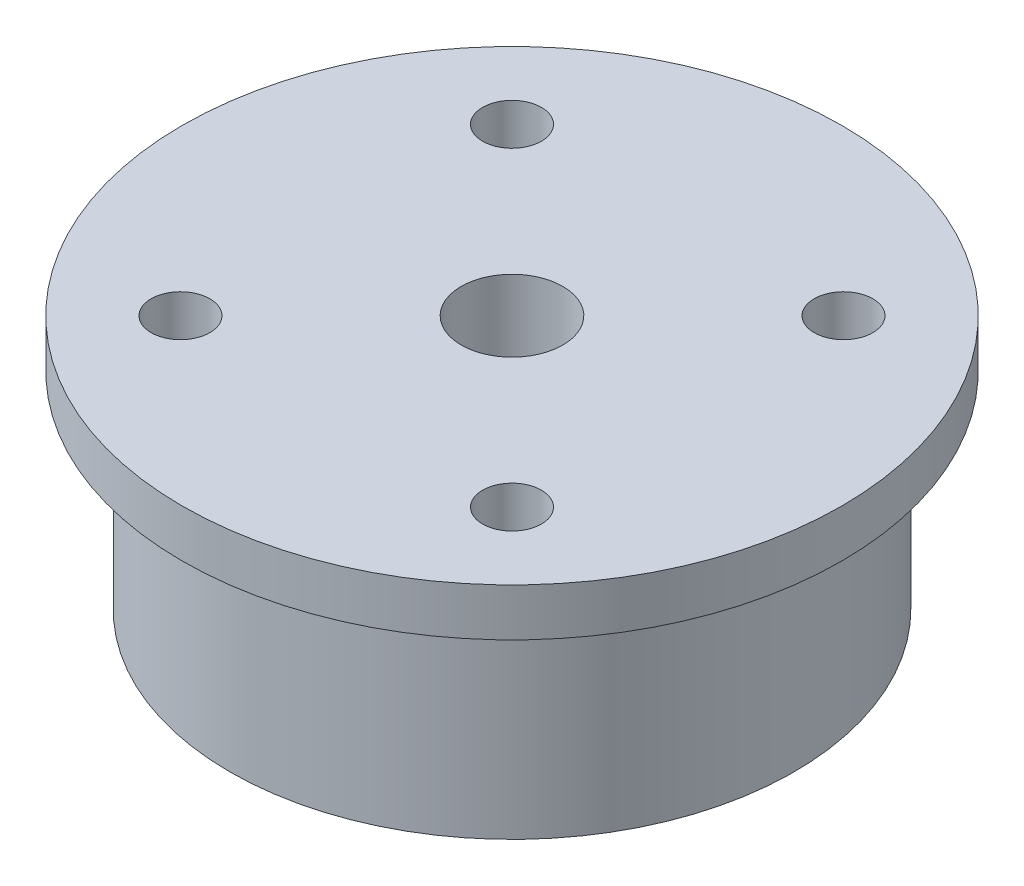
from build123d import *

# Parameters (mm, degrees)
SKETCH1_R           = 8.88
SKETCH1_R_2         = 1.6
BOSS_EXTRUDE1_DEPTH = 6.5
BOSS_EXTRUDE2_START = 6.5
SKETCH1_3_R         = 10.38
SKETCH1_3_R_2       = 1.6
BOSS_EXTRUDE2_DEPTH = 1.5
SKETCH2_R           = 2.35
SKETCH2_R_2         = 2.1
CUT_EXTRUDE1_DEPTH  = 1.2
SKETCH2_2_R         = 2.1
CUT_EXTRUDE2_DEPTH  = 5
SKETCH3_R           = 0.925
CUT_EXTRUDE3_DEPTH  = 3


with BuildPart() as part:
    # Sketch1 → Boss-Extrude1 (new body)
    with BuildSketch(Plane(origin=(0, 0, 0), x_dir=(1, 0, 0), z_dir=(0, 1, 0))):
        with Locations(Location((0, 0, 0), (0, 0, 90))):
            Circle(SKETCH1_R)
        with Locations(Location((0, 0, 0), (0, 0, 90))):
            Circle(SKETCH1_R_2, mode=Mode.SUBTRACT)
    extrude(amount=BOSS_EXTRUDE1_DEPTH)

    # Sketch1<3> → Boss-Extrude2 (add)
    with BuildSketch(Plane(origin=(0, 0, 0), x_dir=(1, 0, 0), z_dir=(0, 1, 0)).offset(BOSS_EXTRUDE2_START)):
        with Locations(Location((0, 0, 0), (0, 0, 270))):
            Circle(SKETCH1_3_R)
        with Locations(Location((0, 0, 0), (0, 0, 90))):
            Circle(SKETCH1_3_R_2, mode=Mode.SUBTRACT)
    extrude(amount=BOSS_EXTRUDE2_DEPTH)

    # Sketch2 → Cut-Extrude1 (cut)
    with BuildSketch(Plane(origin=(0, 0, -8.88), x_dir=(-1, 0, 0), z_dir=(0, 0, -1))):
        with Locations((0, 2.75)):
            Circle(SKETCH2_R)
        with Locations((0, 2.75)):
            Circle(SKETCH2_R_2, mode=Mode.SUBTRACT)
    extrude(amount=-CUT_EXTRUDE1_DEPTH, mode=Mode.SUBTRACT)

    # Sketch2<2> → Cut-Extrude2 (cut)
    with BuildSketch(Plane(origin=(0, 0, -8.88), x_dir=(-1, 0, 0), z_dir=(0, 0, -1))):
        with Locations((0, 2.75)):
            Circle(SKETCH2_2_R)
    extrude(amount=-CUT_EXTRUDE2_DEPTH, mode=Mode.SUBTRACT)

    # Sketch3 → Cut-Extrude3 (cut)
    with BuildSketch(Plane(origin=(0, 8, 0), x_dir=(1, 0, 0), z_dir=(0, 1, 0))):
        with Locations(Location((-5.218448045, 5.218448045, 0), (0, 0, 270))):
            Circle(SKETCH3_R)
        with Locations(Location((-5.218448045, -5.218448045, 0), (0, 0, 270))):
            Circle(SKETCH3_R)
        with Locations(Location((5.218448045, -5.218448045, 0), (0, 0, 270))):
            Circle(SKETCH3_R)
        with Locations(Location((5.218448045, 5.218448045, 0), (0, 0, 270))):
            Circle(SKETCH3_R)
    extrude(amount=-CUT_EXTRUDE3_DEPTH, mode=Mode.SUBTRACT)


solid = part.part
